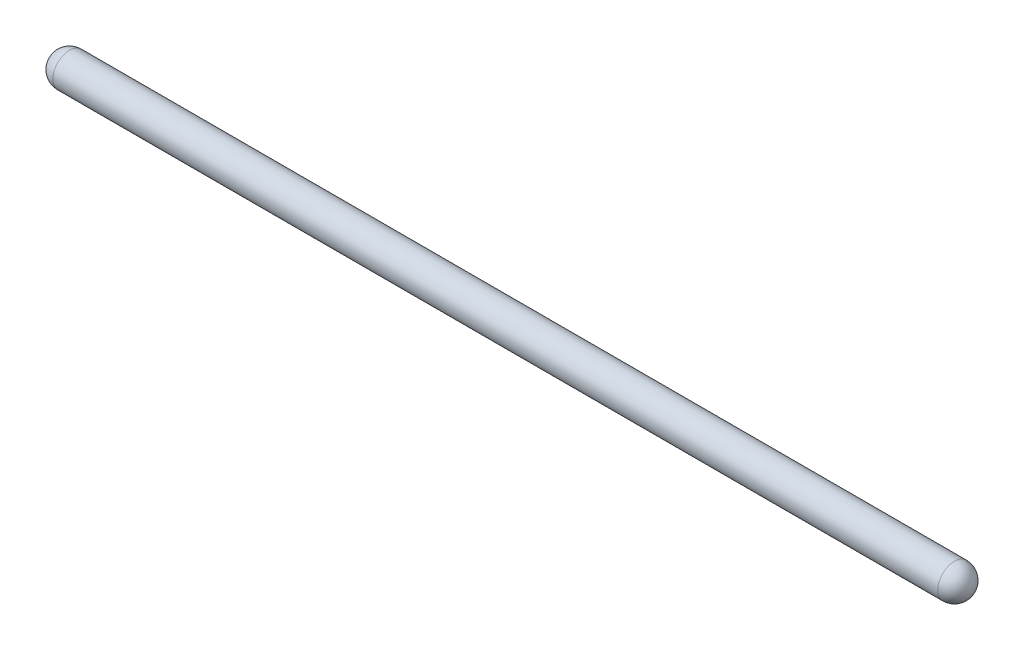
from build123d import *


with BuildPart() as part:
    # Sketch1 → Revolve1 (revolve)
    with BuildSketch(Plane.XY):
        with BuildLine():
            Line((3, 3), (162, 3))
            ThreePointArc((162, 3), (164.121320344, 2.121320344), (165, 0))
            Line((165, 0), (0, 0))
            ThreePointArc((0, 0), (0.878679656, 2.121320344), (3, 3))
        make_face()
    revolve(axis=Axis((0, 0, 0), (1, 0, 0)))


solid = part.part
